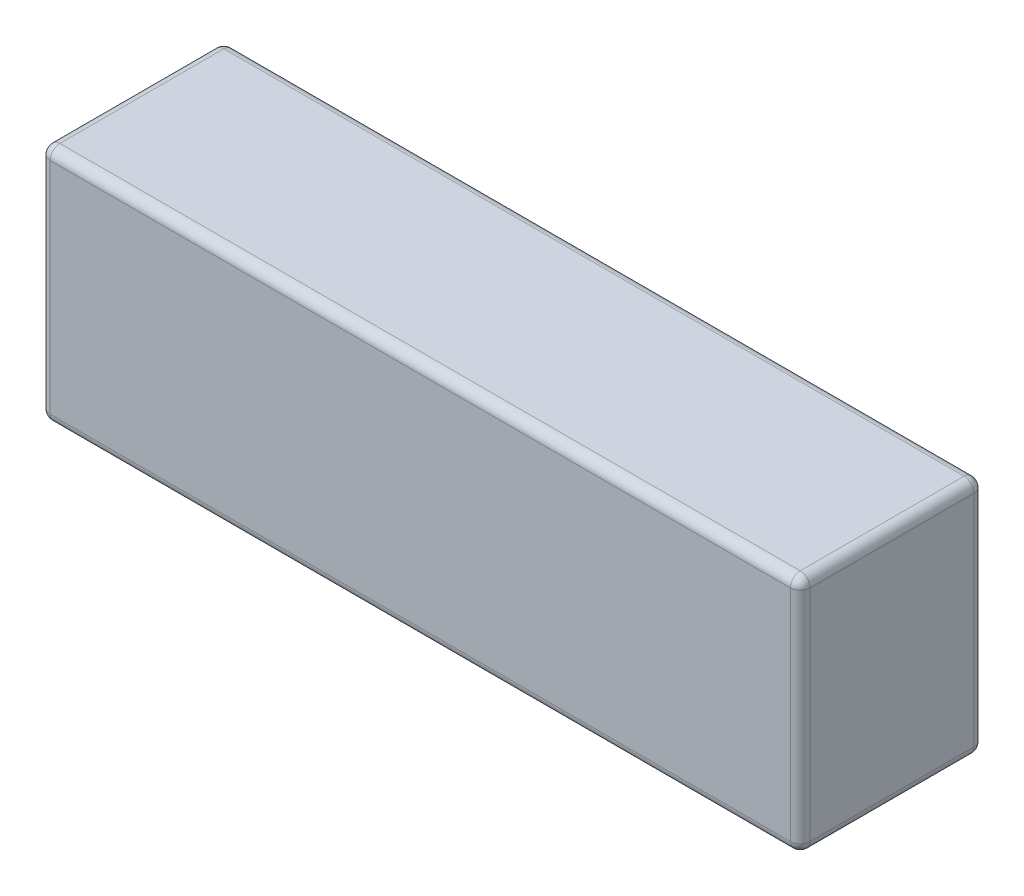
from build123d import *

# Parameters (mm, degrees)
SKETCH1_W           = 154
SKETCH1_H           = 37.2
BOSS_EXTRUDE1_DEPTH = 48.5
FILLET1_R           = 2


with BuildPart() as part:
    # Sketch1 → Boss-Extrude1 (new body)
    with BuildSketch(Plane(origin=(0, 0, 0), x_dir=(1, 0, 0), z_dir=(0, 1, 0))):
        Rectangle(SKETCH1_W, SKETCH1_H)
    extrude(amount=BOSS_EXTRUDE1_DEPTH)

    # Fillet1
    fillet1_edges = [part.edges().sort_by_distance(p)[0] for p in [
        (77, 48.5, 0),
        (0, 48.5, -18.6),
        (-77, 48.5, 0),
        (0, 0, -18.6),
        (77, 0, 0),
        (0, 0, 18.6),
        (-77, 0, 0),
        (-77, 24.25, -18.6),
        (77, 24.25, -18.6),
        (77, 24.25, 18.6),
        (-77, 24.25, 18.6),
        (0, 48.5, 18.6),
    ]]
    fillet(fillet1_edges, radius=FILLET1_R)


solid = part.part
